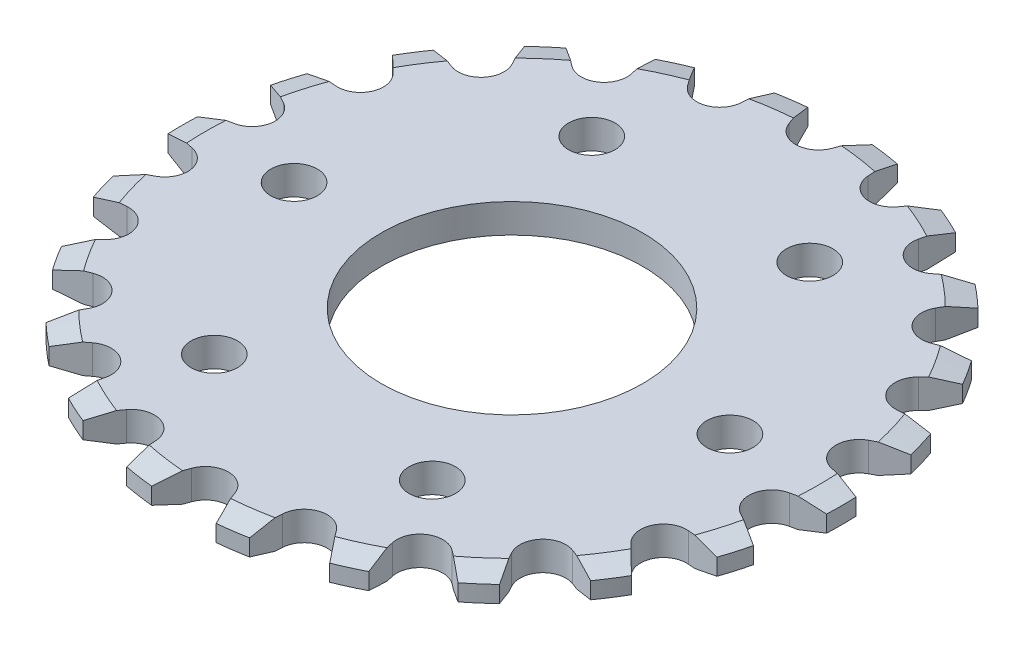
from build123d import *
from OCP.BRepFilletAPI import BRepFilletAPI_MakeChamfer

# Parameters (mm, degrees)
SKETCH1_R           = 36.0172
SKETCH1_R_2         = 14.28115
BOSS_EXTRUDE1_DEPTH = 3.175
SKETCH2_R           = 2.54
CUT_EXTRUDE1_DEPTH  = 52.034870595
CHAMFER1_SIZE       = 2.54
CHAMFER1_SIZE2      = 0.680590949
CUT_EXTRUDE2_DEPTH  = 52.034870595


with BuildPart() as part:
    # Sketch1 → Boss-Extrude1 (new body)
    with BuildSketch(Plane(origin=(0, 0, 0), x_dir=(1, 0, 0), z_dir=(0, 1, 0))):
        with Locations(Location((0, 0, 0), (0, 0, 270))):
            Circle(SKETCH1_R)
        with Locations(Location((0, 0, 0), (0, 0, 270))):
            Circle(SKETCH1_R_2, mode=Mode.SUBTRACT)
    extrude(amount=BOSS_EXTRUDE1_DEPTH)

    # Sketch2 → Cut-Extrude1 (cut, through all)
    with BuildSketch(Plane(origin=(0, 3.175, 0), x_dir=(1, 0, 0), z_dir=(0, 1, 0))):
        with Locations(Location((-23.8125, 0, 0), (0, 0, 270))):
            Circle(SKETCH2_R)
        with Locations(Location((-11.90625, 20.622229928, 0), (0, 0, 270))):
            Circle(SKETCH2_R)
        with Locations(Location((11.90625, 20.622229928, 0), (0, 0, 270))):
            Circle(SKETCH2_R)
        with Locations(Location((23.8125, 0, 0), (0, 0, 270))):
            Circle(SKETCH2_R)
        with Locations(Location((11.90625, -20.622229928, 0), (0, 0, 270))):
            Circle(SKETCH2_R)
        with Locations(Location((-11.90625, -20.622229928, 0), (0, 0, 270))):
            Circle(SKETCH2_R)
    extrude(amount=-CUT_EXTRUDE1_DEPTH, mode=Mode.SUBTRACT)

    # Chamfer1: one chamfer whose edges measure the first distance from different faces: ONE call of the kernel's chamfer builder (chamfer() names one face for all edges)
    chamfer1_edges_1 = [part.edges().sort_by_distance(p)[0] for p in [
        (0, 0, -36.0172),
    ]]
    chamfer1_side_1 = [part.faces().sort_by_distance(p)[0] for p in [
        (0, 0, -34.998479746),
    ]]
    chamfer1_edges_2 = [part.edges().sort_by_distance(p)[0] for p in [
        (0, 3.175, -36.0172),
    ]]
    chamfer1_side_2 = [part.faces().sort_by_distance(p)[0] for p in [
        (0, 3.175, -34.998479746),
    ]]
    chamfer1 = BRepFilletAPI_MakeChamfer(part.part.solid().wrapped)
    for e in chamfer1_edges_1:
        chamfer1.Add(CHAMFER1_SIZE, CHAMFER1_SIZE2, e.wrapped, chamfer1_side_1[0].wrapped)  # the first distance lies on this face
    for e in chamfer1_edges_2:
        chamfer1.Add(CHAMFER1_SIZE, CHAMFER1_SIZE2, e.wrapped, chamfer1_side_2[0].wrapped)  # the first distance lies on this face
    add(Compound.cast(chamfer1.Shape()), mode=Mode.REPLACE)

    # Sketch3 → Cut-Extrude2 (cut, through all)
    with BuildSketch(Plane(origin=(0, 3.175, 0), x_dir=(1, 0, 0), z_dir=(0, 1, 0))):
        with BuildLine():
            Line((2.362951064, 32.642556148), (3.528172983, 35.843977057))
            ThreePointArc((3.528172983, 35.843977057), (0, 36.0172), (-3.528172983, 35.843977057))
            Line((-3.528172983, 35.843977057), (-2.362951064, 32.642556148))
            ThreePointArc((-2.362951064, 32.642556148), (0, 30.988), (2.362951064, 32.642556148))
        make_face()
        with BuildLine():
            Line((6.929235862, 31.986023509), (6.713158117, 35.386045328))
            ThreePointArc((6.713158117, 35.386045328), (10.147217846, 34.558250329), (13.48367249, 33.398042937))
            Line((13.48367249, 33.398042937), (11.463705748, 30.654583019))
            ThreePointArc((11.463705748, 30.654583019), (8.730328471, 29.732768266), (6.929235862, 31.986023509))
        make_face()
        with BuildLine():
            Line((15.660057309, 28.738173475), (16.410629071, 32.061346655))
            ThreePointArc((16.410629071, 32.061346655), (19.47236845, 30.299596743), (22.346805043, 28.246398004))
            Line((22.346805043, 28.246398004), (19.63573917, 26.183157885))
            ThreePointArc((19.63573917, 26.183157885), (16.753377651, 26.068764475), (15.660057309, 28.738173475))
        make_face()
        with BuildLine():
            Line((23.122194046, 23.162127538), (24.778608455, 26.139228353))
            ThreePointArc((24.778608455, 26.139228353), (27.219983569, 23.586250027), (29.399532353, 20.806397893))
            Line((29.399532353, 20.806397893), (26.217001783, 19.590529016))
            ThreePointArc((26.217001783, 19.590529016), (23.41916781, 20.292824423), (23.122194046, 23.162127538))
        make_face()
        with BuildLine():
            Line((28.711108135, 15.709623778), (31.139172346, 18.099465225))
            ThreePointArc((31.139172346, 18.099465225), (32.762397503, 14.962085606), (34.070484397, 11.680787165))
            Line((34.070484397, 11.680787165), (30.674318829, 11.410791995))
            ThreePointArc((30.674318829, 11.410791995), (28.187676272, 12.872880423), (28.711108135, 15.709623778))
        make_face()
        with BuildLine():
            Line((31.974018994, 6.984419728), (34.977025686, 8.593391067))
            ThreePointArc((34.977025686, 8.593391067), (35.650596837, 5.125781993), (35.98124842, 1.608868529))
            Line((35.98124842, 1.608868529), (32.646584991, 2.306620469))
            ThreePointArc((32.646584991, 2.306620469), (30.672586841, 4.410052208), (31.974018994, 6.984419728))
        make_face()
        with BuildLine():
            Line((32.646584991, -2.306620469), (35.98124842, -1.608868529))
            ThreePointArc((35.98124842, -1.608868529), (35.650596837, -5.125781993), (34.977025686, -8.593391067))
            Line((34.977025686, -8.593391067), (31.974018994, -6.984419728))
            ThreePointArc((31.974018994, -6.984419728), (30.672586841, -4.410052208), (32.646584991, -2.306620469))
        make_face()
        with BuildLine():
            Line((30.674318829, -11.410791995), (34.070484397, -11.680787165))
            ThreePointArc((34.070484397, -11.680787165), (32.762397503, -14.962085606), (31.139172346, -18.099465225))
            Line((31.139172346, -18.099465225), (28.711108135, -15.709623778))
            ThreePointArc((28.711108135, -15.709623778), (28.187676272, -12.872880423), (30.674318829, -11.410791995))
        make_face()
        with BuildLine():
            Line((26.217001783, -19.590529016), (29.399532353, -20.806397893))
            ThreePointArc((29.399532353, -20.806397893), (27.219983569, -23.586250027), (24.778608455, -26.139228353))
            Line((24.778608455, -26.139228353), (23.122194046, -23.162127538))
            ThreePointArc((23.122194046, -23.162127538), (23.41916781, -20.292824423), (26.217001783, -19.590529016))
        make_face()
        with BuildLine():
            Line((19.63573917, -26.183157885), (22.346805043, -28.246398004))
            ThreePointArc((22.346805043, -28.246398004), (19.47236845, -30.299596743), (16.410629071, -32.061346655))
            Line((16.410629071, -32.061346655), (15.660057309, -28.738173475))
            ThreePointArc((15.660057309, -28.738173475), (16.753377651, -26.068764475), (19.63573917, -26.183157885))
        make_face()
        with BuildLine():
            Line((11.463705748, -30.654583019), (13.48367249, -33.398042937))
            ThreePointArc((13.48367249, -33.398042937), (10.147217846, -34.558250329), (6.713158117, -35.386045328))
            Line((6.713158117, -35.386045328), (6.929235862, -31.986023509))
            ThreePointArc((6.929235862, -31.986023509), (8.730328471, -29.732768266), (11.463705748, -30.654583019))
        make_face()
        with BuildLine():
            Line((2.362951064, -32.642556148), (3.528172983, -35.843977057))
            ThreePointArc((3.528172983, -35.843977057), (0, -36.0172), (-3.528172983, -35.843977057))
            Line((-3.528172983, -35.843977057), (-2.362951064, -32.642556148))
            ThreePointArc((-2.362951064, -32.642556148), (0, -30.988), (2.362951064, -32.642556148))
        make_face()
        with BuildLine():
            Line((-6.929235862, -31.986023509), (-6.713158117, -35.386045328))
            ThreePointArc((-6.713158117, -35.386045328), (-10.147217846, -34.558250329), (-13.48367249, -33.398042937))
            Line((-13.48367249, -33.398042937), (-11.463705748, -30.654583019))
            ThreePointArc((-11.463705748, -30.654583019), (-8.730328471, -29.732768266), (-6.929235862, -31.986023509))
        make_face()
        with BuildLine():
            Line((-15.660057309, -28.738173475), (-16.410629071, -32.061346655))
            ThreePointArc((-16.410629071, -32.061346655), (-19.47236845, -30.299596743), (-22.346805043, -28.246398004))
            Line((-22.346805043, -28.246398004), (-19.63573917, -26.183157885))
            ThreePointArc((-19.63573917, -26.183157885), (-16.753377651, -26.068764475), (-15.660057309, -28.738173475))
        make_face()
        with BuildLine():
            Line((-23.122194046, -23.162127538), (-24.778608455, -26.139228353))
            ThreePointArc((-24.778608455, -26.139228353), (-27.219983569, -23.586250027), (-29.399532353, -20.806397893))
            Line((-29.399532353, -20.806397893), (-26.217001783, -19.590529016))
            ThreePointArc((-26.217001783, -19.590529016), (-23.41916781, -20.292824423), (-23.122194046, -23.162127538))
        make_face()
        with BuildLine():
            Line((-28.711108135, -15.709623778), (-31.139172346, -18.099465225))
            ThreePointArc((-31.139172346, -18.099465225), (-32.762397503, -14.962085606), (-34.070484397, -11.680787165))
            Line((-34.070484397, -11.680787165), (-30.674318829, -11.410791995))
            ThreePointArc((-30.674318829, -11.410791995), (-28.187676272, -12.872880423), (-28.711108135, -15.709623778))
        make_face()
        with BuildLine():
            Line((-31.974018994, -6.984419728), (-34.977025686, -8.593391067))
            ThreePointArc((-34.977025686, -8.593391067), (-35.650596837, -5.125781993), (-35.98124842, -1.608868529))
            Line((-35.98124842, -1.608868529), (-32.646584991, -2.306620469))
            ThreePointArc((-32.646584991, -2.306620469), (-30.672586841, -4.410052208), (-31.974018994, -6.984419728))
        make_face()
        with BuildLine():
            Line((-32.646584991, 2.306620469), (-35.98124842, 1.608868529))
            ThreePointArc((-35.98124842, 1.608868529), (-35.650596837, 5.125781993), (-34.977025686, 8.593391067))
            Line((-34.977025686, 8.593391067), (-31.974018994, 6.984419728))
            ThreePointArc((-31.974018994, 6.984419728), (-30.672586841, 4.410052208), (-32.646584991, 2.306620469))
        make_face()
        with BuildLine():
            Line((-30.674318829, 11.410791995), (-34.070484397, 11.680787165))
            ThreePointArc((-34.070484397, 11.680787165), (-32.762397503, 14.962085606), (-31.139172346, 18.099465225))
            Line((-31.139172346, 18.099465225), (-28.711108135, 15.709623778))
            ThreePointArc((-28.711108135, 15.709623778), (-28.187676272, 12.872880423), (-30.674318829, 11.410791995))
        make_face()
        with BuildLine():
            Line((-26.217001783, 19.590529016), (-29.399532353, 20.806397893))
            ThreePointArc((-29.399532353, 20.806397893), (-27.219983569, 23.586250027), (-24.778608455, 26.139228353))
            Line((-24.778608455, 26.139228353), (-23.122194046, 23.162127538))
            ThreePointArc((-23.122194046, 23.162127538), (-23.41916781, 20.292824423), (-26.217001783, 19.590529016))
        make_face()
        with BuildLine():
            Line((-19.63573917, 26.183157885), (-22.346805043, 28.246398004))
            ThreePointArc((-22.346805043, 28.246398004), (-19.47236845, 30.299596743), (-16.410629071, 32.061346655))
            Line((-16.410629071, 32.061346655), (-15.660057309, 28.738173475))
            ThreePointArc((-15.660057309, 28.738173475), (-16.753377651, 26.068764475), (-19.63573917, 26.183157885))
        make_face()
        with BuildLine():
            Line((-11.463705748, 30.654583019), (-13.48367249, 33.398042937))
            ThreePointArc((-13.48367249, 33.398042937), (-10.147217846, 34.558250329), (-6.713158117, 35.386045328))
            Line((-6.713158117, 35.386045328), (-6.929235862, 31.986023509))
            ThreePointArc((-6.929235862, 31.986023509), (-8.730328471, 29.732768266), (-11.463705748, 30.654583019))
        make_face()
    extrude(amount=-CUT_EXTRUDE2_DEPTH, mode=Mode.SUBTRACT)


solid = part.part
